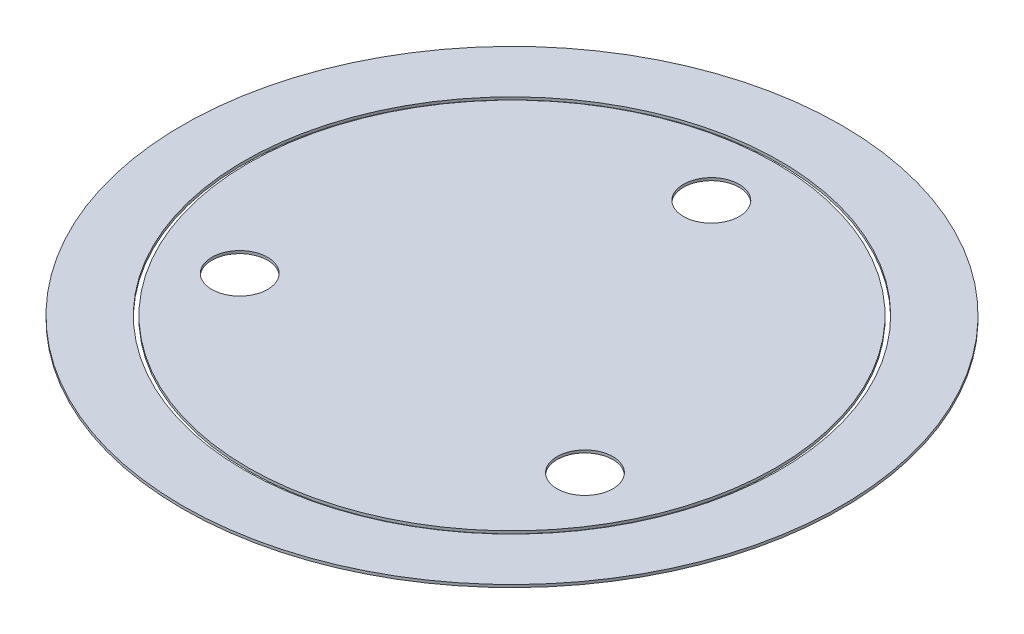
from build123d import *

# Parameters (mm, degrees)
SKETCH1_R             = 24.8
SKETCH1_R_2           = 20.15
BOSS_EXTRUDE1_DEPTH   = 0.2
SKETCH1_R_3           = 19.85
SKETCH1_R_4           = 2.1
BOSS_EXTRUDE1_2_DEPTH = 0.2


with BuildPart() as part:
    # Sketch1 → Boss-Extrude1 (new body)
    with BuildSketch(Plane(origin=(0, 0, 0), x_dir=(1, 0, 0), z_dir=(0, 1, 0))):
        with Locations(Location((0, 0, 0), (0, 0, 270))):
            Circle(SKETCH1_R)
        with Locations(Location((0, 0, 0), (0, 0, 270))):
            Circle(SKETCH1_R_2, mode=Mode.SUBTRACT)
    extrude(amount=BOSS_EXTRUDE1_DEPTH)


with BuildPart() as body_2:
    # Sketch1 → Boss-Extrude1 2 (new body)
    with BuildSketch(Plane(origin=(0, 0, 0), x_dir=(1, 0, 0), z_dir=(0, 1, 0))):
        with Locations(Location((0, 0, 0), (0, 0, 270))):
            Circle(SKETCH1_R_3)
        with Locations(Location((-12.990381057, -7.5, 0), (0, 0, 270))):
            Circle(SKETCH1_R_4, mode=Mode.SUBTRACT)
        with Locations(Location((12.990381057, -7.5, 0), (0, 0, 270))):
            Circle(SKETCH1_R_4, mode=Mode.SUBTRACT)
        with Locations(Location((0, 15, 0), (0, 0, 270))):
            Circle(SKETCH1_R_4, mode=Mode.SUBTRACT)
    extrude(amount=BOSS_EXTRUDE1_2_DEPTH)


solid = Compound([part.part, body_2.part])
